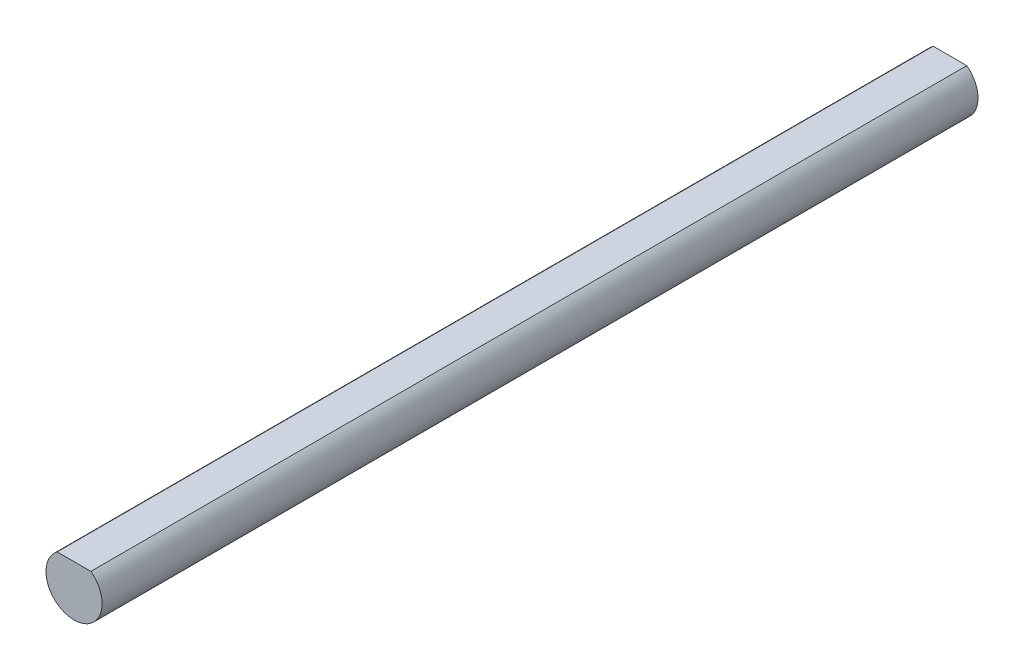
from build123d import *

# Parameters (mm, degrees)
BOSS_EXTRUDE1_DEPTH      = 78
BOSS_EXTRUDE1_DEPTH_BACK = 78
SKETCH1_R                = 5
CUT_EXTRUDE1_DEPTH       = 156


with BuildPart() as part:
    # Sketch1 → Boss-Extrude1 (new, two sides: drawn at the far end of the back side and taken through both)
    with BuildSketch(Plane.XY.offset(-BOSS_EXTRUDE1_DEPTH_BACK)):
        Circle(SKETCH1_R)
    extrude(amount=BOSS_EXTRUDE1_DEPTH + BOSS_EXTRUDE1_DEPTH_BACK)

    # Sketch2 → Cut-Extrude1 (cut)
    with BuildSketch(Plane.XY.offset(78)):
        with BuildLine():
            Line((-3, 4), (3, 4))
            ThreePointArc((3, 4), (0, 5), (-3, 4))
        make_face()
    extrude(amount=-CUT_EXTRUDE1_DEPTH, mode=Mode.SUBTRACT)


solid = part.part
